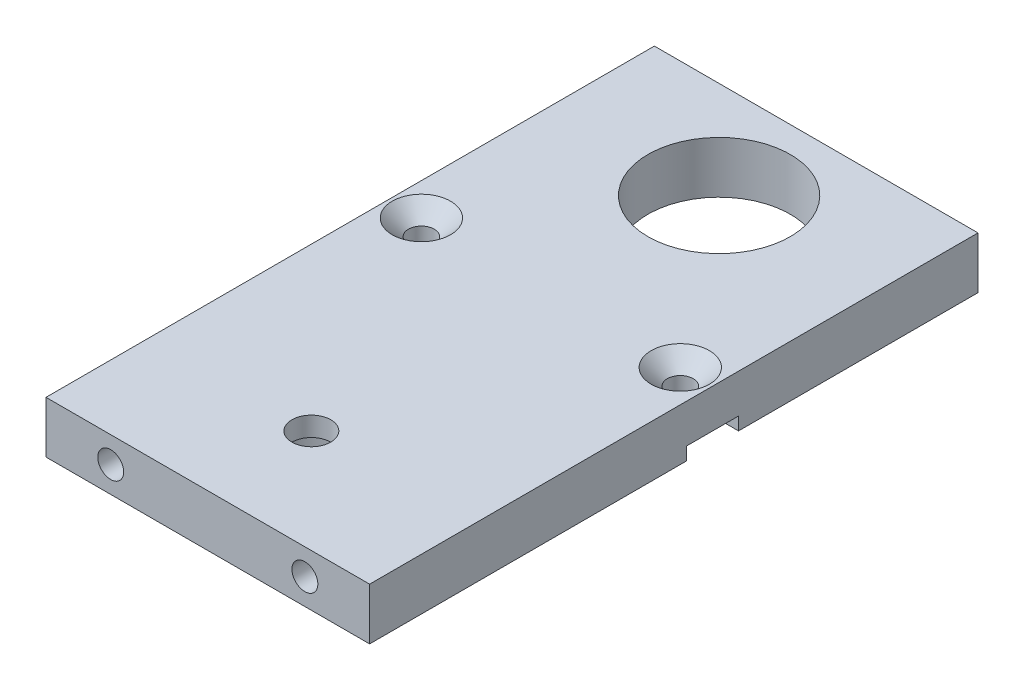
from build123d import *

# Parameters (mm, degrees)
ESQUISSE1_W             = 50
ESQUISSE1_H             = 94
ESQUISSE1_R             = 11
ESQUISSE1_R_2           = 2
BOSS_EXTRU_1_DEPTH      = 8
CHANFREIN1_SIZE         = 2.5
ESQUISSE2_R             = 2
ENL_V_MAT_EXTRU_1_DEPTH = 10
ESQUISSE3_R             = 8
ENL_V_MAT_EXTRU_2_DEPTH = 5
ESQUISSE4_R             = 3
ENL_V_MAT_EXTRU_3_DEPTH = 79.852413099
ESQUISSE5_W             = 50
ESQUISSE5_H             = 8
ENL_V_MAT_EXTRU_4_DEPTH = 2


with BuildPart() as part:
    # Esquisse1 → Boss.-Extru.1 (new body)
    with BuildSketch(Plane(origin=(0, 0, 0), x_dir=(1, 0, 0), z_dir=(0, 1, 0))):
        with Locations((-6.491408935, -25.117918819)):
            Rectangle(ESQUISSE1_W, ESQUISSE1_H)
        with Locations(Location((-6.491408935, 6.882081181, 0), (0, 0, 270))):
            Circle(ESQUISSE1_R, mode=Mode.SUBTRACT)
        with Locations(Location((-26.491408935, -19.117918819, 0), (0, 0, 270))):
            Circle(ESQUISSE1_R_2, mode=Mode.SUBTRACT)
        with Locations(Location((13.508591065, -19.117918819, 0), (0, 0, 270))):
            Circle(ESQUISSE1_R_2, mode=Mode.SUBTRACT)
    extrude(amount=BOSS_EXTRU_1_DEPTH)

    # Chanfrein1
    chanfrein1_edges = [part.edges().sort_by_distance(p)[0] for p in [
        (-26.491408935, 8, 17.117918819),
        (13.508591065, 8, 17.117918819),
    ]]
    chamfer(chanfrein1_edges, length=CHANFREIN1_SIZE)

    # Esquisse2 → Enlèv. mat.-Extru.1 (cut)
    with BuildSketch(Plane.XY.offset(72.117918819)):
        with Locations((-21.491408935, 4)):
            Circle(ESQUISSE2_R)
        with Locations((8.508591065, 4)):
            Circle(ESQUISSE2_R)
    extrude(amount=-ENL_V_MAT_EXTRU_1_DEPTH, mode=Mode.SUBTRACT)

    # Esquisse3 → Enlèv. mat.-Extru.2 (cut)
    with BuildSketch(Plane.XZ):
        with Locations(Location((-6.491408935, 56.117918819, 0), (0, 0, 270))):
            Circle(ESQUISSE3_R)
    extrude(amount=-ENL_V_MAT_EXTRU_2_DEPTH, mode=Mode.SUBTRACT)

    # Esquisse4 → Enlèv. mat.-Extru.3 (cut, through all)
    with BuildSketch(Plane.XZ.offset(-5)):
        with Locations(Location((-6.491408935, 56.117918819, 0), (0, 0, 270))):
            Circle(ESQUISSE4_R)
    extrude(amount=-ENL_V_MAT_EXTRU_3_DEPTH, mode=Mode.SUBTRACT)

    # Esquisse5 → Enlèv. mat.-Extru.4 (cut)
    with BuildSketch(Plane.XZ):
        with Locations((-6.491408935, 19.117918819)):
            Rectangle(ESQUISSE5_W, ESQUISSE5_H)
    extrude(amount=-ENL_V_MAT_EXTRU_4_DEPTH, mode=Mode.SUBTRACT)


solid = part.part
